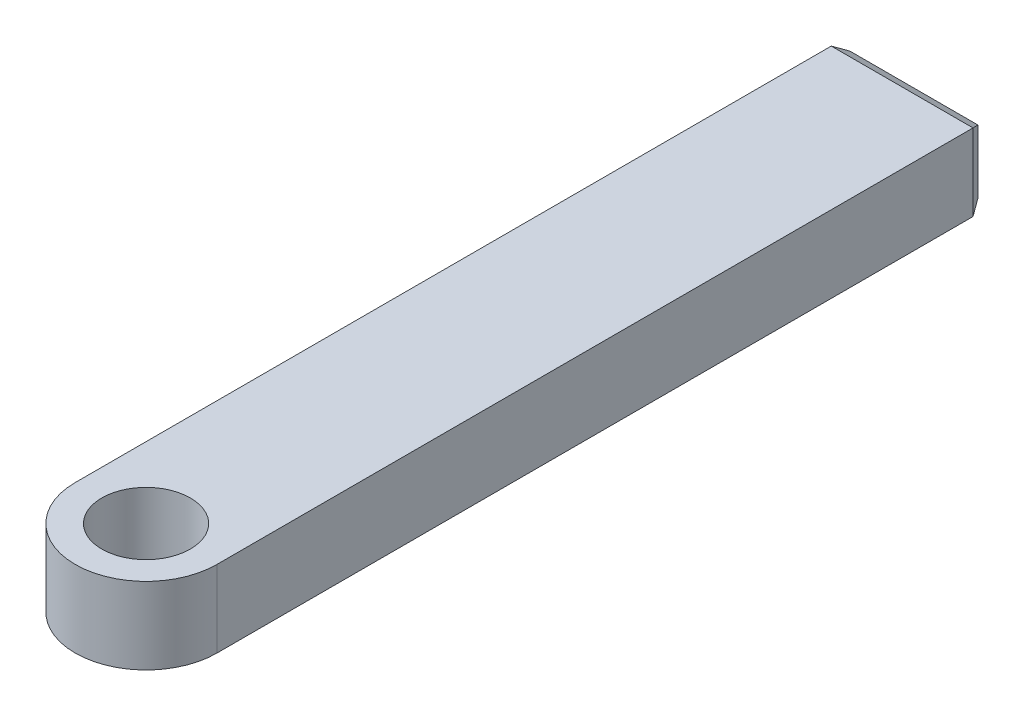
from build123d import *
from OCP.BRepFilletAPI import BRepFilletAPI_MakeChamfer

# Parameters (mm, degrees)
SKETCH1_R           = 3.75
BOSS_EXTRUDE1_DEPTH = 6.5
CHAMFER1_SIZE       = 1
CHAMFER1_SIZE2      = 0.577350269


with BuildPart() as part:
    # Sketch1 → Boss-Extrude1 (new body)
    with BuildSketch(Plane(origin=(0, 0, 0), x_dir=(1, 0, 0), z_dir=(0, 1, 0))):
        with BuildLine():
            Line((-6, 0), (-6, 65))
            Line((-6, 65), (6, 65))
            Line((6, 65), (6, 0))
            ThreePointArc((6, 0), (0, -6), (-6, 0))
        make_face()
        with Locations(Location((0, 0, 0), (0, 0, 90))):
            Circle(SKETCH1_R, mode=Mode.SUBTRACT)
    extrude(amount=BOSS_EXTRUDE1_DEPTH)

    # Chamfer1: one chamfer whose edges measure the first distance from different faces: ONE call of the kernel's chamfer builder (chamfer() names one face for all edges)
    chamfer1_edges_1 = [part.edges().sort_by_distance(p)[0] for p in [
        (0, 6.5, -65),
    ]]
    chamfer1_side_1 = [part.faces().sort_by_distance(p)[0] for p in [
        (0, 6.5, -31.810895579),
    ]]
    chamfer1_edges_2 = [part.edges().sort_by_distance(p)[0] for p in [
        (0, 0, -65),
    ]]
    chamfer1_side_2 = [part.faces().sort_by_distance(p)[0] for p in [
        (0, 0, -31.810895579),
    ]]
    chamfer1_edges_3 = [part.edges().sort_by_distance(p)[0] for p in [
        (-6, 3.25, -65),
    ]]
    chamfer1_side_3 = [part.faces().sort_by_distance(p)[0] for p in [
        (-6, 3.25, -32.5),
    ]]
    chamfer1_edges_4 = [part.edges().sort_by_distance(p)[0] for p in [
        (6, 3.25, -65),
    ]]
    chamfer1_side_4 = [part.faces().sort_by_distance(p)[0] for p in [
        (6, 3.25, -32.5),
    ]]
    chamfer1 = BRepFilletAPI_MakeChamfer(part.part.solid().wrapped)
    for e in chamfer1_edges_1:
        chamfer1.Add(CHAMFER1_SIZE, CHAMFER1_SIZE2, e.wrapped, chamfer1_side_1[0].wrapped)  # the first distance lies on this face
    for e in chamfer1_edges_2:
        chamfer1.Add(CHAMFER1_SIZE, CHAMFER1_SIZE2, e.wrapped, chamfer1_side_2[0].wrapped)  # the first distance lies on this face
    for e in chamfer1_edges_3:
        chamfer1.Add(CHAMFER1_SIZE, CHAMFER1_SIZE2, e.wrapped, chamfer1_side_3[0].wrapped)  # the first distance lies on this face
    for e in chamfer1_edges_4:
        chamfer1.Add(CHAMFER1_SIZE, CHAMFER1_SIZE2, e.wrapped, chamfer1_side_4[0].wrapped)  # the first distance lies on this face
    add(Compound.cast(chamfer1.Shape()), mode=Mode.REPLACE)


solid = part.part
